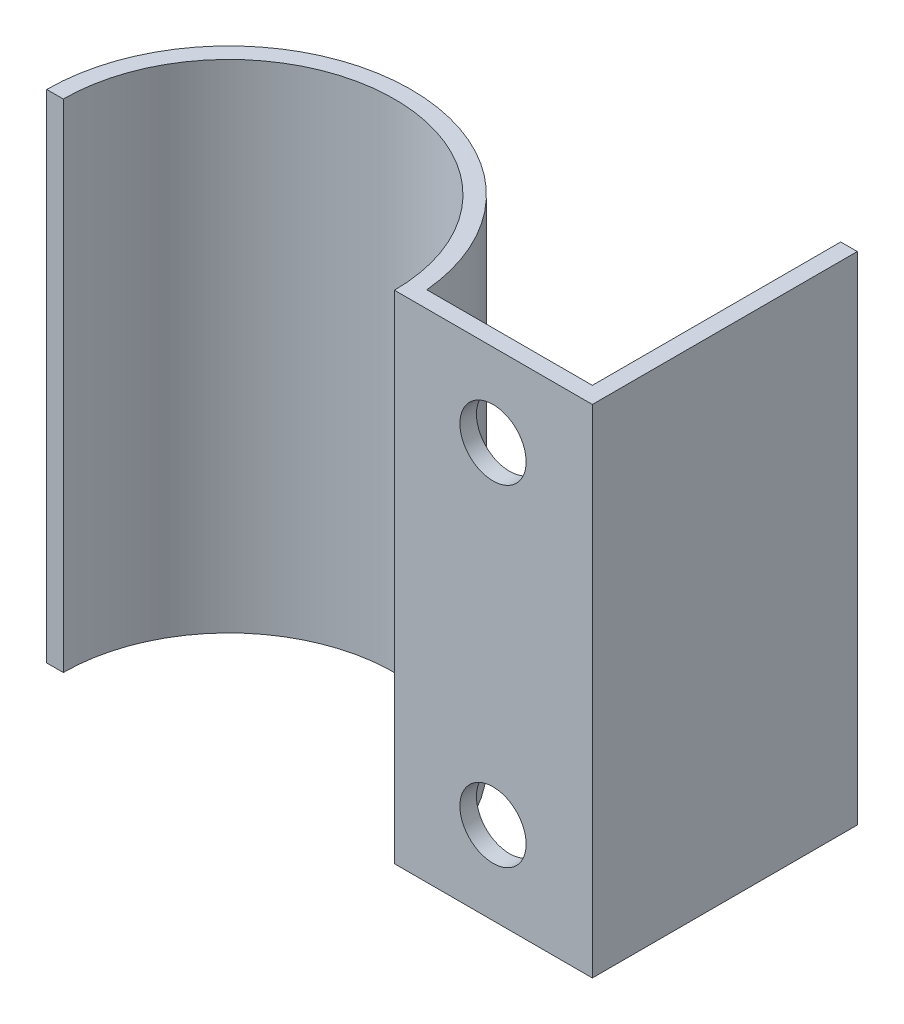
from build123d import *

# Parameters (mm, degrees)
BOSS_EXTRUDE1_DEPTH = 30
SKETCH2_R           = 2
CUT_EXTRUDE1_DEPTH  = 30


with BuildPart() as part:
    # Sketch1 → Boss-Extrude1 (new body)
    with BuildSketch(Plane(origin=(0, 0, 0), x_dir=(1, 0, 0), z_dir=(0, 1, 0))):
        with BuildLine():
            Line((10, 0), (20.95445115, 0))
            Line((20.95445115, 0), (21.95445115, 0))
            Line((21.95445115, 0), (21.95445115, 16))
            Line((21.95445115, 16), (20.95445115, 16))
            Line((20.95445115, 16), (20.95445115, 1))
            Line((20.95445115, 1), (10.95445115, 1))
            ThreePointArc((10.95445115, 1), (-0.500518406, 10.988606887), (-11, 0))
            Line((-11, 0), (-10, 0))
            ThreePointArc((-10, 0), (0, 10), (10, 0))
        make_face()
    extrude(amount=BOSS_EXTRUDE1_DEPTH)

    # Sketch2 → Cut-Extrude1 (cut)
    with BuildSketch(Plane(origin=(0, 0, -1), x_dir=(-1, 0, 0), z_dir=(0, 0, -1))):
        with Locations((-15.95445115, 25)):
            Circle(SKETCH2_R)
        with Locations((-15.95445115, 5)):
            Circle(SKETCH2_R)
    extrude(amount=-CUT_EXTRUDE1_DEPTH, mode=Mode.SUBTRACT)


solid = part.part
